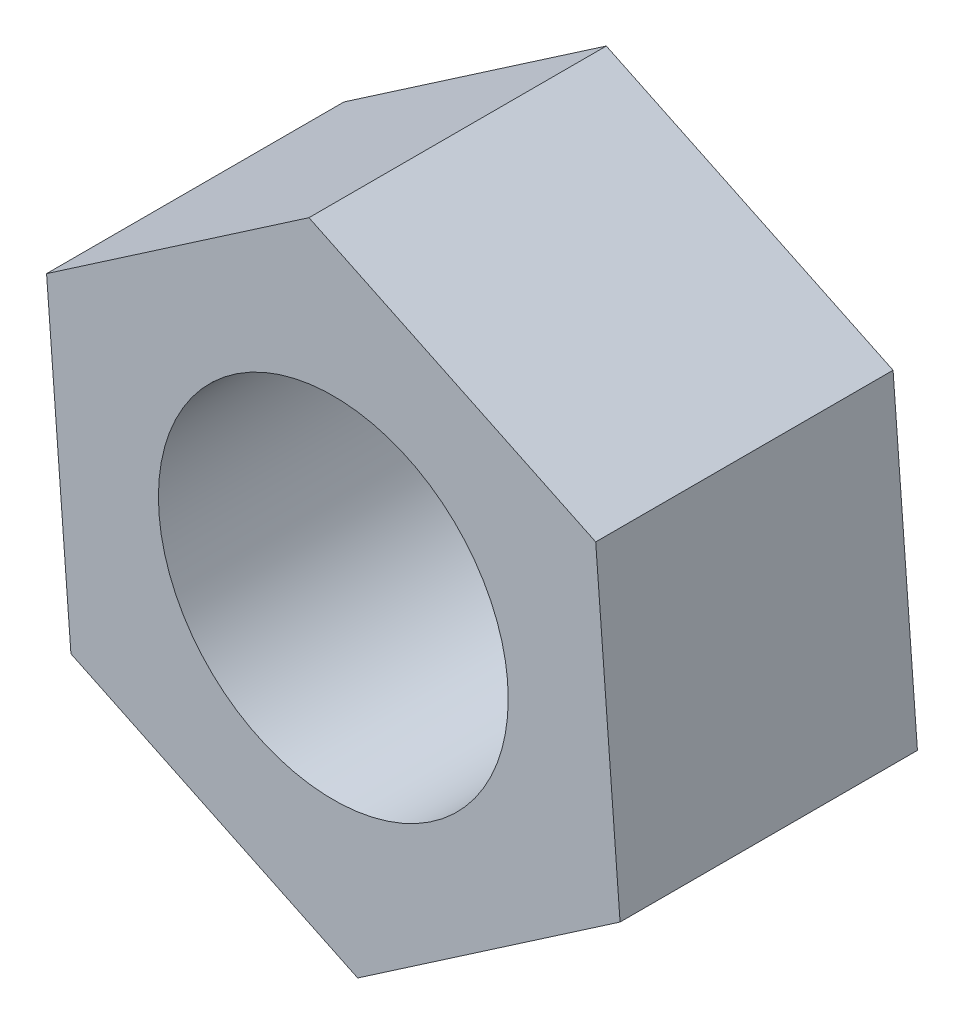
from build123d import *

# Parameters (mm, degrees)
SKETCH1_R           = 4
BOSS_EXTRUDE1_DEPTH = 6.8


with BuildPart() as part:
    # Sketch1 → Boss-Extrude1 (new body)
    with BuildSketch(Plane.XY):
        Polygon((-0.557368355, 7.25), (-6.557368355, 3.142304845), (-6, -4.107695155), (0.557368355, -7.25), (6.557368355, -3.142304845), (6, 4.107695155), align=None)
        Circle(SKETCH1_R, mode=Mode.SUBTRACT)
    extrude(amount=BOSS_EXTRUDE1_DEPTH)


solid = part.part
